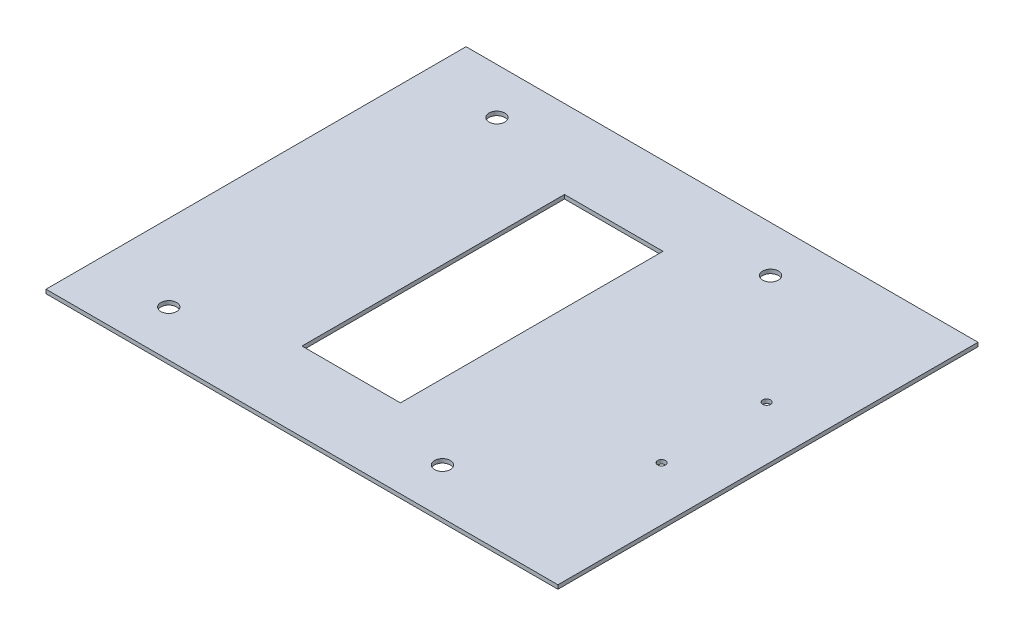
from build123d import *

# Parameters (mm, degrees)
ESQUISSE1_W             = 390
ESQUISSE1_H             = 320
BASE_EXTRUSION_DEPTH    = 3
ESQUISSE2_W             = 75
ESQUISSE2_H             = 200
ENL_V_MAT_EXTRU_1_DEPTH = 4
ESQUISSE3_R             = 6
ENL_V_MAT_EXTRU_2_DEPTH = 4
ESQUISSE4_R             = 3
ENL_V_MAT_EXTRU_3_DEPTH = 10


with BuildPart() as part:
    # Esquisse1 → Base-Extrusion (new body)
    with BuildSketch(Plane(origin=(0, 0, 0), x_dir=(1, 0, 0), z_dir=(0, 1, 0))):
        with Locations((195, 160)):
            Rectangle(ESQUISSE1_W, ESQUISSE1_H)
    extrude(amount=BASE_EXTRUSION_DEPTH)

    # Esquisse2 → Enlèv. mat.-Extru.1 (cut)
    with BuildSketch(Plane(origin=(0, 3, 0), x_dir=(-1, 0, 0), z_dir=(0, 1, 0))):
        with Locations((-172.5, -160)):
            Rectangle(ESQUISSE2_W, ESQUISSE2_H)
    extrude(amount=-ENL_V_MAT_EXTRU_1_DEPTH, mode=Mode.SUBTRACT)

    # Esquisse3 → Enlèv. mat.-Extru.2 (cut)
    with BuildSketch(Plane(origin=(0, 3, 0), x_dir=(-1, 0, 0), z_dir=(0, 1, 0))):
        with Locations(Location((-267, -285, 0), (0, 0, 90))):
            Circle(ESQUISSE3_R)
        with Locations(Location((-58.5, -285, 0), (0, 0, 90))):
            Circle(ESQUISSE3_R)
        with Locations(Location((-267, -35, 0), (0, 0, 90))):
            Circle(ESQUISSE3_R)
        with Locations(Location((-58.5, -35, 0), (0, 0, 90))):
            Circle(ESQUISSE3_R)
    extrude(amount=-ENL_V_MAT_EXTRU_2_DEPTH, mode=Mode.SUBTRACT)

    # Esquisse4 → Enlèv. mat.-Extru.3 (cut)
    with BuildSketch(Plane(origin=(0, 3, 0), x_dir=(-1, 0, 0), z_dir=(0, 1, 0))):
        with Locations(Location((-349, -200, 0), (0, 0, 90))):
            Circle(ESQUISSE4_R)
        with Locations(Location((-349, -120, 0), (0, 0, 90))):
            Circle(ESQUISSE4_R)
    extrude(amount=-ENL_V_MAT_EXTRU_3_DEPTH, mode=Mode.SUBTRACT)


solid = part.part
